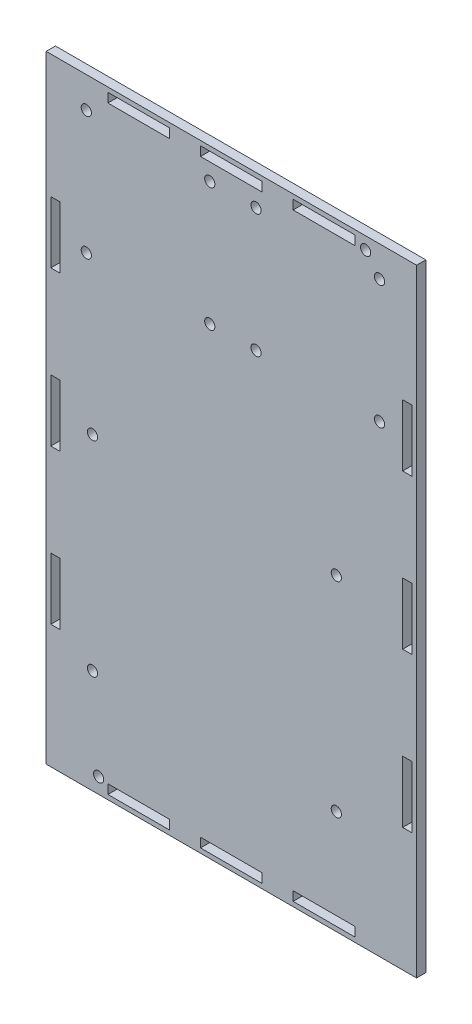
from build123d import *

# Parameters (mm, degrees)
SKETCH1_W           = 120
SKETCH1_H           = 200
SKETCH1_R           = 1.65
SKETCH1_W_2         = 3
SKETCH1_H_2         = 20
SKETCH1_W_3         = 20
SKETCH1_H_3         = 3
BOSS_EXTRUDE1_DEPTH = 3


with BuildPart() as part:
    # Sketch1 → Boss-Extrude1 (new body)
    with BuildSketch(Plane.XY):
        with Locations((-8.436124494, -75.291436911)):
            Rectangle(SKETCH1_W, SKETCH1_H)
        with Locations((-55.436124494, 14.708563089)):
            Circle(SKETCH1_R, mode=Mode.SUBTRACT)
        with Locations((-15.436124494, 14.708563089)):
            Circle(SKETCH1_R, mode=Mode.SUBTRACT)
        with Locations((-15.436124494, -25.291436911)):
            Circle(SKETCH1_R, mode=Mode.SUBTRACT)
        with Locations((-55.436124494, -25.291436911)):
            Circle(SKETCH1_R, mode=Mode.SUBTRACT)
        with Locations((-0.436547566, 14.821221739)):
            Circle(SKETCH1_R, mode=Mode.SUBTRACT)
        with Locations((39.563452434, 14.821221739)):
            Circle(SKETCH1_R, mode=Mode.SUBTRACT)
        with Locations((39.563452434, -25.178778261)):
            Circle(SKETCH1_R, mode=Mode.SUBTRACT)
        with Locations((-0.436547566, -25.178778261)):
            Circle(SKETCH1_R, mode=Mode.SUBTRACT)
        with Locations((-53.436124494, -75.291436911)):
            Circle(SKETCH1_R, mode=Mode.SUBTRACT)
        with Locations((25.563875506, -75.291436911)):
            Circle(SKETCH1_R, mode=Mode.SUBTRACT)
        with Locations((25.563875506, -141.591436911)):
            Circle(SKETCH1_R, mode=Mode.SUBTRACT)
        with Locations((-53.436124494, -141.591436911)):
            Circle(SKETCH1_R, mode=Mode.SUBTRACT)
        with Locations((-51.436124494, -170.291436911)):
            Circle(SKETCH1_R, mode=Mode.SUBTRACT)
        with Locations((35.063875506, 20.708563089)):
            Circle(SKETCH1_R, mode=Mode.SUBTRACT)
        with Locations((-65.436124494, -25.291436911)):
            Rectangle(SKETCH1_W_2, SKETCH1_H_2, mode=Mode.SUBTRACT)
        with Locations((-65.436124494, -75.291436911)):
            Rectangle(SKETCH1_W_2, SKETCH1_H_2, mode=Mode.SUBTRACT)
        with Locations((-65.436124494, -125.291436911)):
            Rectangle(SKETCH1_W_2, SKETCH1_H_2, mode=Mode.SUBTRACT)
        with Locations((48.563875506, -25.291436911)):
            Rectangle(SKETCH1_W_2, SKETCH1_H_2, mode=Mode.SUBTRACT)
        with Locations((48.563875506, -75.291436911)):
            Rectangle(SKETCH1_W_2, SKETCH1_H_2, mode=Mode.SUBTRACT)
        with Locations((48.563875506, -125.291436911)):
            Rectangle(SKETCH1_W_2, SKETCH1_H_2, mode=Mode.SUBTRACT)
        with Locations((-38.436124494, -172.291436911)):
            Rectangle(SKETCH1_W_3, SKETCH1_H_3, mode=Mode.SUBTRACT)
        with Locations((-8.436124494, -172.291436911)):
            Rectangle(SKETCH1_W_3, SKETCH1_H_3, mode=Mode.SUBTRACT)
        with Locations((21.563875506, -172.291436911)):
            Rectangle(SKETCH1_W_3, SKETCH1_H_3, mode=Mode.SUBTRACT)
        with Locations((-38.436124494, 21.708563089)):
            Rectangle(SKETCH1_W_3, SKETCH1_H_3, mode=Mode.SUBTRACT)
        with Locations((-8.436124494, 21.708563089)):
            Rectangle(SKETCH1_W_3, SKETCH1_H_3, mode=Mode.SUBTRACT)
        with Locations((21.563875506, 21.708563089)):
            Rectangle(SKETCH1_W_3, SKETCH1_H_3, mode=Mode.SUBTRACT)
    extrude(amount=BOSS_EXTRUDE1_DEPTH)


solid = part.part
